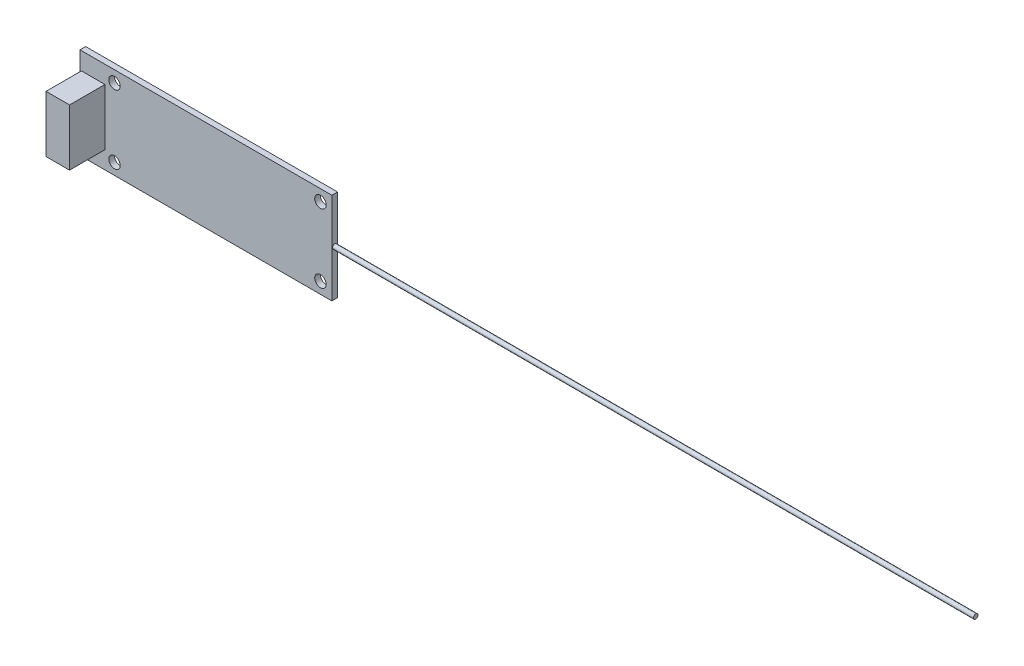
from build123d import *

# Parameters (mm, degrees)
SKETCH1_W                             = 69.85
SKETCH1_H                             = 25.4
EXTRUDE1_DEPTH                        = 1.5748
F_1_8_0_125_DIAMETER_HOLE1_AT_2_COUNT = 2
F_1_8_0_125_DIAMETER_HOLE1_AT_2_PITCH = 57.13222
SKETCH4_R                             = 0.635
BOSS_EXTRUDE1_DEPTH                   = 177.8
SKETCH5_W                             = 8.128
SKETCH5_H                             = 8.7376
USB_CONNECTOR_DEPTH                   = 4.1402
SKETCH8_W                             = 6.5278
SKETCH8_H                             = 15.6718
BOSS_EXTRUDE3_DEPTH                   = 9.8298


with BuildPart() as part:
    # Sketch1 → Extrude1 (new body)
    with BuildSketch(Plane.XY):
        Rectangle(SKETCH1_W, SKETCH1_H)
    extrude(amount=EXTRUDE1_DEPTH)

    # Sketch3 → 1/8 (0.125) Diameter Hole1 (revolve, cut)
    with BuildSketch(Plane(origin=(-25.38222, 9.525, 1.5748), x_dir=(0, -1, 0), z_dir=(1, 0, 0))):
        Polygon((0, 0), (0, 16.955866233), (1.5875, 16.002), (1.5875, 0), align=None)
    f_1_8_0_125_diameter_hole1 = revolve(axis=Axis((-25.38222, 9.525, 7.9248), (0, 0, -1)), mode=Mode.SUBTRACT)

    # 1/8 (0.125) Diameter Hole1 at 2: 1/8 (0.125) Diameter Hole1 ×2
    with Locations(*[(i * F_1_8_0_125_DIAMETER_HOLE1_AT_2_PITCH, 0, 0) for i in range(1, F_1_8_0_125_DIAMETER_HOLE1_AT_2_COUNT)]):
        add(f_1_8_0_125_diameter_hole1, mode=Mode.SUBTRACT)

    # Mirror1: 1/8 (0.125) Diameter Hole1 across plane
    add(f_1_8_0_125_diameter_hole1.mirror(Plane.ZX), mode=Mode.SUBTRACT)

    # Mirror1 copy 1 sketch → Mirror1 copy 1 (revolve, cut)
    with BuildSketch(Plane(origin=(31.75, -9.525, 1.5748), x_dir=(0, 1, 0), z_dir=(1, 0, 0))):
        Polygon((0, 0), (0, -16.955866233), (1.5875, -16.002), (1.5875, 0), align=None)
    revolve(axis=Axis((31.75, -9.525, 7.9248), (0, 0, 1)), mode=Mode.SUBTRACT)

    # Sketch4 → Boss-Extrude1 (add)
    with BuildSketch(Plane(origin=(34.925, 0, 0), x_dir=(0, 0, -1), z_dir=(1, 0, 0))):
        with Locations(Location((-0.772028936, 0, 0), (0, 0, 180))):
            Circle(SKETCH4_R)
    extrude(amount=BOSS_EXTRUDE1_DEPTH)

    # Sketch5 → USB Connector (add)
    with BuildSketch(Plane(origin=(0, 0, 0), x_dir=(-1, 0, 0), z_dir=(0, 0, -1))):
        with Locations((13.072066229, -8.3312)):
            Rectangle(SKETCH5_W, SKETCH5_H)
    extrude(amount=USB_CONNECTOR_DEPTH)

    # Sketch8 → Boss-Extrude3 (add)
    with BuildSketch(Plane.XY.offset(1.5748)):
        with Locations((-31.2801, 0)):
            Rectangle(SKETCH8_W, SKETCH8_H)
    extrude(amount=BOSS_EXTRUDE3_DEPTH)


solid = part.part
